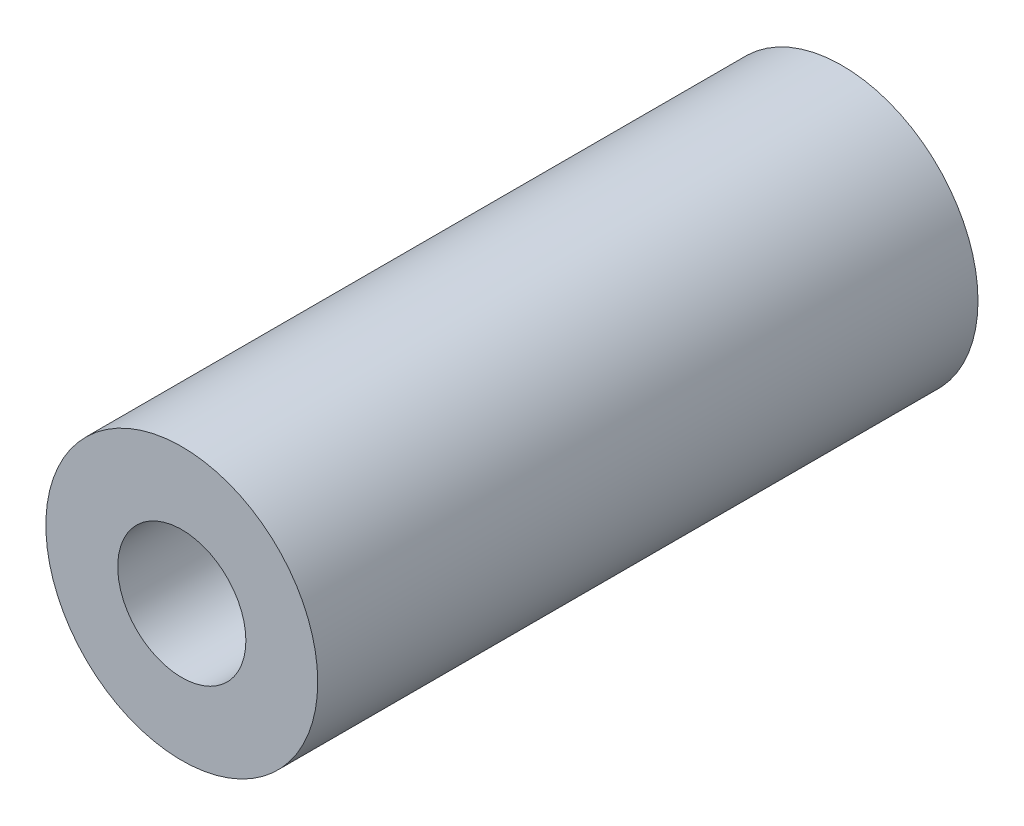
from build123d import *

# Parameters (mm, degrees)
S01_ANNULAR_SECTION_R      = 7
S01_ANNULAR_SECTION_R_2    = 3.3
F_01_ANNULAR_SECTION_DEPTH = 34


with BuildPart() as part:
    # S01 - Annular section → 01 - Annular section (new body)
    with BuildSketch(Plane.XY):
        Circle(S01_ANNULAR_SECTION_R)
        Circle(S01_ANNULAR_SECTION_R_2, mode=Mode.SUBTRACT)
    extrude(amount=F_01_ANNULAR_SECTION_DEPTH)


solid = part.part
